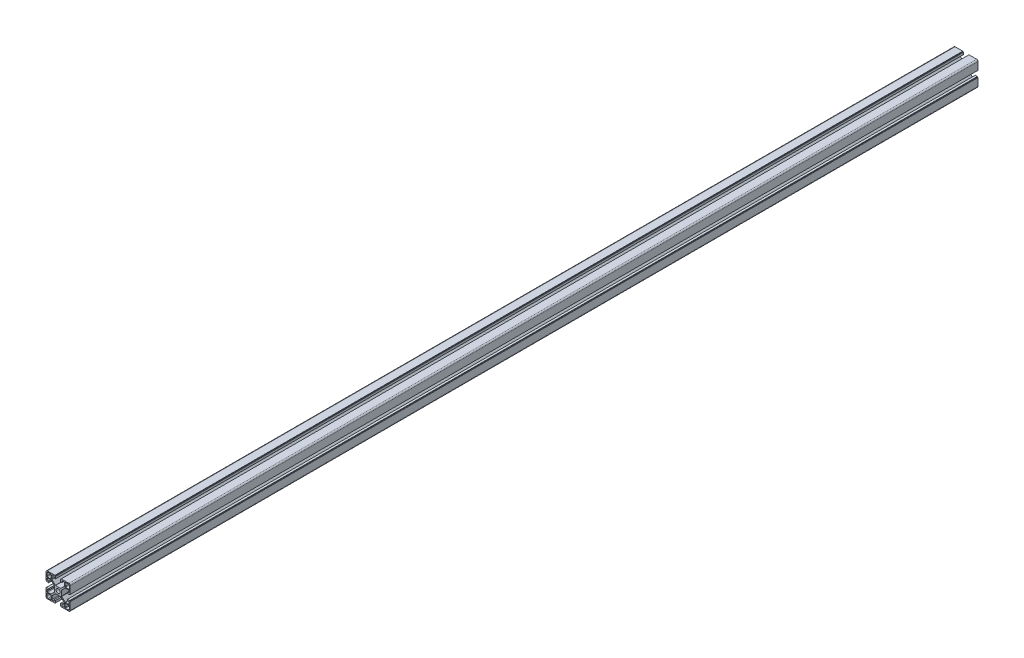
from build123d import *

# Parameters (mm, degrees)
SKETCH1_R           = 3.4
BOSS_EXTRUDE1_DEPTH = 1500


with BuildPart() as part:
    # Sketch1 → Boss-Extrude1 (new body)
    with BuildSketch(Plane.XY):
        with BuildLine():
            Line((20, 17.75), (20, 5.15))
            Line((20, 5.15), (19, 5.15))
            Line((19, 5.15), (19, 4.15))
            Line((19, 4.15), (15.4, 4.15))
            Line((15.4, 4.15), (15.4, 6.35))
            Line((15.4, 6.35), (16.95, 6.35))
            ThreePointArc((16.95, 6.35), (17.833883476, 6.716116524), (18.2, 7.6))
            Line((18.2, 7.6), (18.2, 9.3))
            ThreePointArc((18.2, 9.3), (17.907106781, 10.007106781), (17.2, 10.3))
            Line((17.2, 10.3), (12.03669957, 10.3))
            ThreePointArc((12.03669957, 10.3), (11.73040037, 10.239040459), (11.470780817, 10.065452001))
            Line((11.470780817, 10.065452001), (6.084081247, 4.674305984))
            ThreePointArc((6.084081247, 4.674305984), (5.910833239, 4.414848262), (5.85, 4.108853983))
            Line((5.85, 4.108853983), (5.85, -4.108853983))
            ThreePointArc((5.85, -4.108853983), (5.910833239, -4.414848262), (6.084081247, -4.674305984))
            Line((6.084081247, -4.674305984), (11.470780817, -10.065452001))
            ThreePointArc((11.470780817, -10.065452001), (11.73040037, -10.239040459), (12.03669957, -10.3))
            Line((12.03669957, -10.3), (17.2, -10.3))
            ThreePointArc((17.2, -10.3), (17.907106781, -10.007106781), (18.2, -9.3))
            Line((18.2, -9.3), (18.2, -7.6))
            ThreePointArc((18.2, -7.6), (17.833883476, -6.716116524), (16.95, -6.35))
            Line((16.95, -6.35), (15.4, -6.35))
            Line((15.4, -6.35), (15.4, -4.15))
            Line((15.4, -4.15), (19, -4.15))
            Line((19, -4.15), (19, -5.15))
            Line((19, -5.15), (20, -5.15))
            Line((20, -5.15), (20, -17.75))
            ThreePointArc((20, -17.75), (19.340990258, -19.340990258), (17.75, -20))
            Line((17.75, -20), (5.15, -20))
            Line((5.15, -20), (5.15, -19))
            Line((5.15, -19), (4.15, -19))
            Line((4.15, -19), (4.15, -15.4))
            Line((4.15, -15.4), (6.35, -15.4))
            Line((6.35, -15.4), (6.35, -16.95))
            ThreePointArc((6.35, -16.95), (6.716116524, -17.833883476), (7.6, -18.2))
            Line((7.6, -18.2), (9.3, -18.2))
            ThreePointArc((9.3, -18.2), (10.007106781, -17.907106781), (10.3, -17.2))
            Line((10.3, -17.2), (10.3, -12.054477022))
            ThreePointArc((10.3, -12.054477022), (10.239166761, -11.748482743), (10.065918753, -11.489025021))
            Line((10.065918753, -11.489025021), (4.665899173, -6.084547999))
            ThreePointArc((4.665899173, -6.084547999), (4.406279619, -5.910959541), (4.09998042, -5.85))
            Line((4.09998042, -5.85), (-4.09998042, -5.85))
            ThreePointArc((-4.09998042, -5.85), (-4.406279619, -5.910959541), (-4.665899173, -6.084547999))
            Line((-4.665899173, -6.084547999), (-10.065918753, -11.489025021))
            ThreePointArc((-10.065918753, -11.489025021), (-10.239166761, -11.748482743), (-10.3, -12.054477022))
            Line((-10.3, -12.054477022), (-10.3, -17.2))
            ThreePointArc((-10.3, -17.2), (-10.007106781, -17.907106781), (-9.3, -18.2))
            Line((-9.3, -18.2), (-7.6, -18.2))
            ThreePointArc((-7.6, -18.2), (-6.716116524, -17.833883476), (-6.35, -16.95))
            Line((-6.35, -16.95), (-6.35, -15.4))
            Line((-6.35, -15.4), (-4.15, -15.4))
            Line((-4.15, -15.4), (-4.15, -19))
            Line((-4.15, -19), (-5.15, -19))
            Line((-5.15, -19), (-5.15, -20))
            Line((-5.15, -20), (-17.75, -20))
            ThreePointArc((-17.75, -20), (-19.340990258, -19.340990258), (-20, -17.75))
            Line((-20, -17.75), (-20, -5.15))
            Line((-20, -5.15), (-19, -5.15))
            Line((-19, -5.15), (-19, -4.15))
            Line((-19, -4.15), (-15.4, -4.15))
            Line((-15.4, -4.15), (-15.4, -6.35))
            Line((-15.4, -6.35), (-16.95, -6.35))
            ThreePointArc((-16.95, -6.35), (-17.833883476, -6.716116524), (-18.2, -7.6))
            Line((-18.2, -7.6), (-18.2, -9.3))
            ThreePointArc((-18.2, -9.3), (-17.907106781, -10.007106781), (-17.2, -10.3))
            Line((-17.2, -10.3), (-12.03669957, -10.3))
            ThreePointArc((-12.03669957, -10.3), (-11.73040037, -10.239040459), (-11.470780817, -10.065452001))
            Line((-11.470780817, -10.065452001), (-6.084081247, -4.674305984))
            ThreePointArc((-6.084081247, -4.674305984), (-5.910833239, -4.414848262), (-5.85, -4.108853983))
            Line((-5.85, -4.108853983), (-5.85, 4.108853983))
            ThreePointArc((-5.85, 4.108853983), (-5.910833239, 4.414848262), (-6.084081247, 4.674305984))
            Line((-6.084081247, 4.674305984), (-11.470780817, 10.065452001))
            ThreePointArc((-11.470780817, 10.065452001), (-11.73040037, 10.239040459), (-12.03669957, 10.3))
            Line((-12.03669957, 10.3), (-17.2, 10.3))
            ThreePointArc((-17.2, 10.3), (-17.907106781, 10.007106781), (-18.2, 9.3))
            Line((-18.2, 9.3), (-18.2, 7.6))
            ThreePointArc((-18.2, 7.6), (-17.833883476, 6.716116524), (-16.95, 6.35))
            Line((-16.95, 6.35), (-15.4, 6.35))
            Line((-15.4, 6.35), (-15.4, 4.15))
            Line((-15.4, 4.15), (-19, 4.15))
            Line((-19, 4.15), (-19, 5.15))
            Line((-19, 5.15), (-20, 5.15))
            Line((-20, 5.15), (-20, 17.75))
            ThreePointArc((-20, 17.75), (-19.340990258, 19.340990258), (-17.75, 20))
            Line((-17.75, 20), (-5.15, 20))
            Line((-5.15, 20), (-5.15, 19))
            Line((-5.15, 19), (-4.15, 19))
            Line((-4.15, 19), (-4.15, 15.4))
            Line((-4.15, 15.4), (-6.35, 15.4))
            Line((-6.35, 15.4), (-6.35, 16.95))
            ThreePointArc((-6.35, 16.95), (-6.716116524, 17.833883476), (-7.6, 18.2))
            Line((-7.6, 18.2), (-9.3, 18.2))
            ThreePointArc((-9.3, 18.2), (-10.007106781, 17.907106781), (-10.3, 17.2))
            Line((-10.3, 17.2), (-10.3, 12.054477022))
            ThreePointArc((-10.3, 12.054477022), (-10.239166761, 11.748482743), (-10.065918753, 11.489025021))
            Line((-10.065918753, 11.489025021), (-4.665899173, 6.084547999))
            ThreePointArc((-4.665899173, 6.084547999), (-4.406279619, 5.910959541), (-4.09998042, 5.85))
            Line((-4.09998042, 5.85), (4.09998042, 5.85))
            ThreePointArc((4.09998042, 5.85), (4.406279619, 5.910959541), (4.665899173, 6.084547999))
            Line((4.665899173, 6.084547999), (10.065918753, 11.489025021))
            ThreePointArc((10.065918753, 11.489025021), (10.239166761, 11.748482743), (10.3, 12.054477022))
            Line((10.3, 12.054477022), (10.3, 17.2))
            ThreePointArc((10.3, 17.2), (10.007106781, 17.907106781), (9.3, 18.2))
            Line((9.3, 18.2), (7.6, 18.2))
            ThreePointArc((7.6, 18.2), (6.716116524, 17.833883476), (6.35, 16.95))
            Line((6.35, 16.95), (6.35, 15.4))
            Line((6.35, 15.4), (4.15, 15.4))
            Line((4.15, 15.4), (4.15, 19))
            Line((4.15, 19), (5.15, 19))
            Line((5.15, 19), (5.15, 20))
            Line((5.15, 20), (17.75, 20))
            ThreePointArc((17.75, 20), (19.340990258, 19.340990258), (20, 17.75))
        make_face()
        Circle(SKETCH1_R, mode=Mode.SUBTRACT)
        with BuildLine():
            Line((18.6, 16.35), (18.6, 12.2))
            ThreePointArc((18.6, 12.2), (18.365685425, 11.634314575), (17.8, 11.4))
            Line((17.8, 11.4), (12.2, 11.4))
            ThreePointArc((12.2, 11.4), (11.634314575, 11.634314575), (11.4, 12.2))
            Line((11.4, 12.2), (11.4, 17.8))
            ThreePointArc((11.4, 17.8), (11.634314575, 18.365685425), (12.2, 18.6))
            Line((12.2, 18.6), (16.35, 18.6))
            ThreePointArc((16.35, 18.6), (17.940990258, 17.940990258), (18.6, 16.35))
        make_face(mode=Mode.SUBTRACT)
        with BuildLine():
            Line((-12.2, 18.6), (-16.35, 18.6))
            ThreePointArc((-16.35, 18.6), (-17.940990258, 17.940990258), (-18.6, 16.35))
            Line((-18.6, 16.35), (-18.6, 12.2))
            ThreePointArc((-18.6, 12.2), (-18.365685425, 11.634314575), (-17.8, 11.4))
            Line((-17.8, 11.4), (-12.2, 11.4))
            ThreePointArc((-12.2, 11.4), (-11.634314575, 11.634314575), (-11.4, 12.2))
            Line((-11.4, 12.2), (-11.4, 17.8))
            ThreePointArc((-11.4, 17.8), (-11.634314575, 18.365685425), (-12.2, 18.6))
        make_face(mode=Mode.SUBTRACT)
        with BuildLine():
            Line((-18.6, -16.35), (-18.6, -12.2))
            ThreePointArc((-18.6, -12.2), (-18.365685425, -11.634314575), (-17.8, -11.4))
            Line((-17.8, -11.4), (-12.2, -11.4))
            ThreePointArc((-12.2, -11.4), (-11.634314575, -11.634314575), (-11.4, -12.2))
            Line((-11.4, -12.2), (-11.4, -17.8))
            ThreePointArc((-11.4, -17.8), (-11.634314575, -18.365685425), (-12.2, -18.6))
            Line((-12.2, -18.6), (-16.35, -18.6))
            ThreePointArc((-16.35, -18.6), (-17.940990258, -17.940990258), (-18.6, -16.35))
        make_face(mode=Mode.SUBTRACT)
        with BuildLine():
            Line((12.2, -18.6), (16.35, -18.6))
            ThreePointArc((16.35, -18.6), (17.940990258, -17.940990258), (18.6, -16.35))
            Line((18.6, -16.35), (18.6, -12.2))
            ThreePointArc((18.6, -12.2), (18.365685425, -11.634314575), (17.8, -11.4))
            Line((17.8, -11.4), (12.2, -11.4))
            ThreePointArc((12.2, -11.4), (11.634314575, -11.634314575), (11.4, -12.2))
            Line((11.4, -12.2), (11.4, -17.8))
            ThreePointArc((11.4, -17.8), (11.634314575, -18.365685425), (12.2, -18.6))
        make_face(mode=Mode.SUBTRACT)
    extrude(amount=BOSS_EXTRUDE1_DEPTH)


solid = part.part
